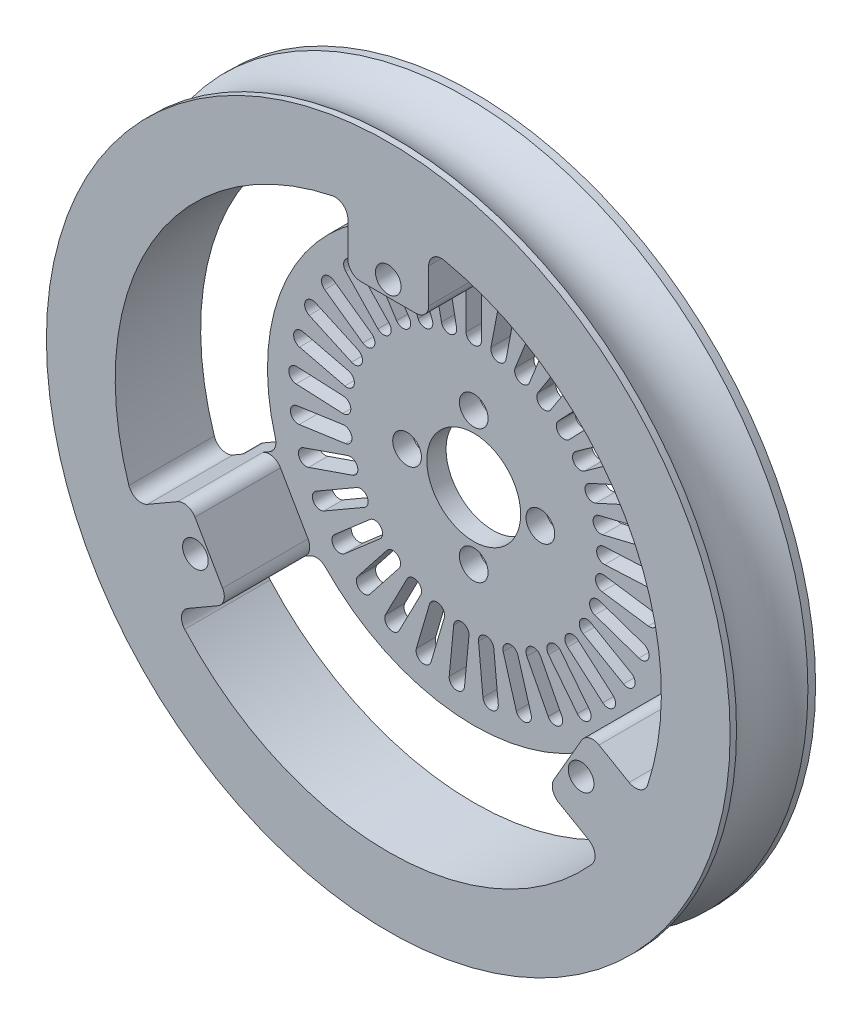
from build123d import *

# Parameters (mm, degrees)
ESQUISSE1_R             = 33.866666667
BOSS_EXTRU_1_DEPTH      = 8.466666667
ENL_V_MAT_EXTRU_1_REACH = 50.637
BOSS_EXTRU_2_DEPTH      = 1.905
ESQUISSE9_R             = 4.6482
ENL_V_MAT_EXTRU_5_DEPTH = 50.00483335
ESQUISSE10_R            = 1.4224
ENL_V_MAT_EXTRU_6_DEPTH = 49.637297074
ESQUISSE11_R            = 1.27
ENL_V_MAT_EXTRU_7_DEPTH = 50.00483335
ENL_V_MAT_EXTRU_8_DEPTH = 50.00483335


with BuildPart() as part:
    # Esquisse1 → Boss.-Extru.1 (new body)
    with BuildSketch(Plane.XY):
        Circle(ESQUISSE1_R)
    extrude(amount=BOSS_EXTRU_1_DEPTH)

    # Esquisse2 → Enlèv. mat.-Extru.1 (cut, up to next)
    with BuildSketch(Plane.XY.offset(8.466666667), mode=Mode.PRIVATE) as enl_v_mat_extru_1_sk1:
        with BuildLine():
            Line((4.0005, 25.236517009), (4.0005, 21.800553049))
            ThreePointArc((4.0005, 21.800553049), (3.628525612, 20.902527437), (2.7305, 20.530553049))
            Line((2.7305, 20.530553049), (-2.7305, 20.530553049))
            ThreePointArc((-2.7305, 20.530553049), (-3.628525612, 20.902527437), (-4.0005, 21.800553049))
            Line((-4.0005, 21.800553049), (-4.0005, 25.236517009))
            ThreePointArc((-4.0005, 25.236517009), (-4.469510234, 26.222070353), (-5.530130542, 26.479695187))
            ThreePointArc((-5.530130542, 26.479695187), (-23.426853198, 13.5255), (-25.697153987, -8.450614058))
            ThreePointArc((-25.697153987, -8.450614058), (-24.943734182, -9.240325772), (-23.855714833, -9.153723877))
            Line((-23.855714833, -9.153723877), (-20.880082757, -7.435741897))
            ThreePointArc((-20.880082757, -7.435741897), (-19.91638257, -7.30886836), (-19.145230494, -7.90059416))
            Line((-19.145230494, -7.90059416), (-16.414730494, -12.62995889))
            ThreePointArc((-16.414730494, -12.62995889), (-16.287856958, -13.593659077), (-16.879582757, -14.364811152))
            Line((-16.879582757, -14.364811152), (-19.855214833, -16.082793132))
            ThreePointArc((-19.855214833, -16.082793132), (-20.474223949, -16.981744581), (-20.167023445, -18.029081129))
            ThreePointArc((-20.167023445, -18.029081129), (0, -27.051), (20.167023445, -18.029081129))
            ThreePointArc((20.167023445, -18.029081129), (20.474223949, -16.981744581), (19.855214833, -16.082793132))
            Line((19.855214833, -16.082793132), (16.879582757, -14.364811152))
            ThreePointArc((16.879582757, -14.364811152), (16.287856958, -13.593659077), (16.414730494, -12.62995889))
            Line((16.414730494, -12.62995889), (19.145230494, -7.90059416))
            ThreePointArc((19.145230494, -7.90059416), (19.91638257, -7.30886836), (20.880082757, -7.435741897))
            Line((20.880082757, -7.435741897), (23.855714833, -9.153723877))
            ThreePointArc((23.855714833, -9.153723877), (24.943734182, -9.240325772), (25.697153987, -8.450614058))
            ThreePointArc((25.697153987, -8.450614058), (23.426853198, 13.5255), (5.530130542, 26.479695187))
            ThreePointArc((5.530130542, 26.479695187), (4.469510234, 26.222070353), (4.0005, 25.236517009))
        make_face()
    enl_v_mat_extru_1_tool1 = extrude(enl_v_mat_extru_1_sk1.sketch, amount=-ENL_V_MAT_EXTRU_1_REACH, mode=Mode.PRIVATE) & part.part
    add(enl_v_mat_extru_1_tool1.solids().sort_by_distance((0, 0, 8.466667))[0], mode=Mode.SUBTRACT)

    # Esquisse7 → Enlèvement de matière-Révolution4 (revolve, cut)
    with BuildSketch(Plane(origin=(0, 0, 0), x_dir=(1, 0, 0), z_dir=(0, 1, 0)), mode=Mode.PRIVATE) as enl_vement_de_mati_re_r_volution4_sk:
        with BuildLine():
            Line((-33.866666667, -0.762), (-33.866666667, -7.831666667))
            ThreePointArc((-33.866666667, -7.831666667), (-32.596666667, -4.296833333), (-33.866666667, -0.762))
        make_face()
    revolve(enl_vement_de_mati_re_r_volution4_sk.sketch.rotate(Axis((0, 0, 31.089854895), (0, 0, -1)), 180), axis=Axis((0, 0, 31.089854895), (0, 0, -1)), mode=Mode.SUBTRACT)

    # Esquisse8 → Boss.-Extru.2 (add)
    with BuildSketch(Plane.XY):
        with BuildLine():
            Line((-22.75586257, -8.518723877), (-20.234115503, -7.062792529))
            ThreePointArc((-20.234115503, -7.062792529), (-19.691815298, -6.43924293), (-19.64798528, -5.614026266))
            ThreePointArc((-19.64798528, -5.614026266), (-17.696622909, 10.21715), (-4.962103277, 19.822667519))
            ThreePointArc((-4.962103277, 19.822667519), (-4.269359691, 20.27323376), (-4.0005, 21.054654313))
            Line((-4.0005, 21.054654313), (-4.0005, 23.966517009))
            ThreePointArc((-4.0005, 23.966517009), (-3.628525612, 24.864542621), (-2.7305, 25.236517009))
            Line((-2.7305, 25.236517009), (2.7305, 25.236517009))
            ThreePointArc((2.7305, 25.236517009), (3.628525612, 24.864542621), (4.0005, 23.966517009))
            Line((4.0005, 23.966517009), (4.0005, 21.054654313))
            ThreePointArc((4.0005, 21.054654313), (4.269359691, 20.27323376), (4.962103277, 19.822667519))
            ThreePointArc((4.962103277, 19.822667519), (17.696622909, 10.21715), (19.64798528, -5.614026266))
            ThreePointArc((19.64798528, -5.614026266), (19.691815298, -6.43924293), (20.234115503, -7.062792529))
            Line((20.234115503, -7.062792529), (22.75586257, -8.518723877))
            ThreePointArc((22.75586257, -8.518723877), (23.347588369, -9.289875952), (23.220714833, -10.25357614))
            Line((23.220714833, -10.25357614), (20.490214833, -14.98294087))
            ThreePointArc((20.490214833, -14.98294087), (19.719062757, -15.574666669), (18.75536257, -15.447793132))
            Line((18.75536257, -15.447793132), (16.233615503, -13.991861784))
            ThreePointArc((16.233615503, -13.991861784), (15.422455608, -13.83399083), (14.685882004, -14.208641253))
            ThreePointArc((14.685882004, -14.208641253), (0, -20.4343), (-14.685882004, -14.208641253))
            ThreePointArc((-14.685882004, -14.208641253), (-15.422455608, -13.83399083), (-16.233615503, -13.991861784))
            Line((-16.233615503, -13.991861784), (-18.75536257, -15.447793132))
            ThreePointArc((-18.75536257, -15.447793132), (-19.719062757, -15.574666669), (-20.490214833, -14.98294087))
            Line((-20.490214833, -14.98294087), (-23.220714833, -10.25357614))
            ThreePointArc((-23.220714833, -10.25357614), (-23.347588369, -9.289875952), (-22.75586257, -8.518723877))
        make_face()
    extrude(amount=-BOSS_EXTRU_2_DEPTH)

    # Esquisse9 → Enlèv. mat.-Extru.5 (cut, through all)
    with BuildSketch(Plane(origin=(0, 0, -1.905), x_dir=(-1, 0, 0), z_dir=(0, 0, -1))):
        Circle(ESQUISSE9_R)
    extrude(amount=-ENL_V_MAT_EXTRU_5_DEPTH, mode=Mode.SUBTRACT)

    # Esquisse10 → Enlèv. mat.-Extru.6 (cut, through all)
    with BuildSketch(Plane.XY):
        with Locations((0, 6.604)):
            Circle(ESQUISSE10_R)
        with Locations((6.604, 0)):
            Circle(ESQUISSE10_R)
        with Locations((0, -6.604)):
            Circle(ESQUISSE10_R)
        with Locations((-6.604, 0)):
            Circle(ESQUISSE10_R)
    extrude(amount=-ENL_V_MAT_EXTRU_6_DEPTH, mode=Mode.SUBTRACT)

    # Esquisse11 → Enlèv. mat.-Extru.7 (cut, through all)
    with BuildSketch(Plane(origin=(0, 0, -1.905), x_dir=(-1, 0, 0), z_dir=(0, 0, -1))):
        with Locations((0, 22.061517009)):
            Circle(ESQUISSE11_R)
        with Locations((19.105834176, -11.030758505)):
            Circle(ESQUISSE11_R)
        with Locations((-19.105834176, -11.030758505)):
            Circle(ESQUISSE11_R)
    extrude(amount=-ENL_V_MAT_EXTRU_7_DEPTH, mode=Mode.SUBTRACT)

    # Esquisse12 → Enlèv. mat.-Extru.8 (cut, through all)
    with BuildSketch(Plane(origin=(0, 0, -1.905), x_dir=(-1, 0, 0), z_dir=(0, 0, -1))):
        with BuildLine():
            Line((0.762, 17.5768), (0.762, 12.954))
            ThreePointArc((0.762, 12.954), (0, 12.192), (-0.762, 12.954))
            Line((-0.762, 12.954), (-0.762, 17.5768))
            ThreePointArc((-0.762, 17.5768), (0, 18.3388), (0.762, 17.5768))
        make_face()
        with BuildLine():
            Line((4.074660939, 17.114954878), (3.199790287, 12.575694896))
            ThreePointArc((3.199790287, 12.575694896), (2.307351171, 11.971674677), (1.703330952, 12.864113793))
            Line((1.703330952, 12.864113793), (2.578201605, 17.403373774))
            ThreePointArc((2.578201605, 17.403373774), (3.47064072, 18.007393993), (4.074660939, 17.114954878))
        make_face()
        with BuildLine():
            Line((7.240053016, 16.034530694), (5.521931816, 11.742871413))
            ThreePointArc((5.521931816, 11.742871413), (4.531308659, 11.318661839), (4.107099086, 12.309284996))
            Line((4.107099086, 12.309284996), (5.825220286, 16.600944276))
            ThreePointArc((5.825220286, 16.600944276), (6.815843442, 17.02515385), (7.240053016, 16.034530694))
        make_face()
        with BuildLine():
            Line((10.143770712, 14.374576793), (7.644496341, 10.485629961))
            ThreePointArc((7.644496341, 10.485629961), (6.591492846, 10.256563072), (6.362425957, 11.309566567))
            Line((6.362425957, 11.309566567), (8.861700328, 15.198513399))
            ThreePointArc((8.861700328, 15.198513399), (9.914703823, 15.427580288), (10.143770712, 14.374576793))
        make_face()
        with BuildLine():
            Line((12.680866106, 12.195088234), (9.490768852, 8.849410523))
            ThreePointArc((9.490768852, 8.849410523), (8.413443308, 8.823765393), (8.387798178, 9.901090936))
            Line((8.387798178, 9.901090936), (11.577895432, 13.246768648))
            ThreePointArc((11.577895432, 13.246768648), (12.655220976, 13.272413778), (12.680866106, 12.195088234))
        make_face()
        with BuildLine():
            Line((14.759641959, 9.574837413), (10.994020248, 6.893350331))
            ThreePointArc((10.994020248, 6.893350331), (9.931310007, 7.072053841), (10.110013518, 8.134764082))
            Line((10.110013518, 8.134764082), (13.875635229, 10.816251164))
            ThreePointArc((13.875635229, 10.816251164), (14.938345469, 10.637547653), (14.759641959, 9.574837413))
        make_face()
        with BuildLine():
            Line((16.304965896, 6.60852702), (12.099919108, 4.688146498))
            ThreePointArc((12.099919108, 4.688146498), (11.090233287, 5.064739839), (11.466826628, 6.074425659))
            Line((11.466826628, 6.074425659), (15.671873416, 7.994806181))
            ThreePointArc((15.671873416, 7.994806181), (16.681559236, 7.61821284), (16.304965896, 6.60852702))
        make_face()
        with BuildLine():
            Line((17.260985883, 3.403367243), (12.768495365, 2.313500836))
            ThreePointArc((12.768495365, 2.313500836), (11.848326641, 2.874372942), (12.409198747, 3.794541666))
            Line((12.409198747, 3.794541666), (16.901689265, 4.884408073))
            ThreePointArc((16.901689265, 4.884408073), (17.821857989, 4.323535967), (17.260985883, 3.403367243))
        make_face()
        with BuildLine():
            Line((17.593148867, 0.075200906), (12.975584932, -0.144760775))
            ThreePointArc((12.975584932, -0.144760775), (12.178190599, 0.580118718), (12.903070092, 1.37751305))
            Line((12.903070092, 1.37751305), (17.520634027, 1.597474731))
            ThreePointArc((17.520634027, 1.597474731), (18.31802836, 0.872595238), (17.593148867, 0.075200906))
        make_face()
        with BuildLine():
            Line((17.289449613, -3.255683388), (12.713703051, -2.597790354))
            ThreePointArc((12.713703051, -2.597790354), (12.067903019, -1.735102508), (12.930590865, -1.089302476))
            Line((12.930590865, -1.089302476), (17.506337426, -1.747195511))
            ThreePointArc((17.506337426, -1.747195511), (18.152137458, -2.609883356), (17.289449613, -3.255683388))
        make_face()
        with BuildLine():
            Line((16.360864602, -6.468898801), (11.992314818, -4.956929021))
            ThreePointArc((11.992314818, -4.956929021), (11.521449982, -3.987612609), (12.490766394, -3.516747773))
            Line((12.490766394, -3.516747773), (16.859316178, -5.028717554))
            ThreePointArc((16.859316178, -5.028717554), (17.330181014, -5.998033966), (16.360864602, -6.468898801))
        make_face()
        with BuildLine():
            Line((14.840955317, -9.448311358), (10.837493081, -7.136911358))
            ThreePointArc((10.837493081, -7.136911358), (10.558581723, -6.096), (11.599493081, -5.817088642))
            Line((11.599493081, -5.817088642), (15.602955317, -8.128488642))
            ThreePointArc((15.602955317, -8.128488642), (15.881866675, -9.1694), (14.840955317, -9.448311358))
        make_face()
        with BuildLine():
            Line((12.784655239, -12.086237324), (9.290976107, -9.058947123))
            ThreePointArc((9.290976107, -9.058947123), (9.214098811, -7.984062068), (10.288983865, -7.907184772))
            Line((10.288983865, -7.907184772), (13.782662998, -10.934474973))
            ThreePointArc((13.782662998, -10.934474973), (13.859540294, -12.009360028), (12.784655239, -12.086237324))
        make_face()
        with BuildLine():
            Line((10.266284411, -14.287335183), (7.408659049, -10.653568937))
            ThreePointArc((7.408659049, -10.653568937), (7.53659436, -9.583559331), (8.606603966, -9.711494642))
            Line((8.606603966, -9.711494642), (11.464229327, -13.345260888))
            ThreePointArc((11.464229327, -13.345260888), (11.336294017, -14.415270494), (10.266284411, -14.287335183))
        make_face()
        with BuildLine():
            Line((7.376863315, -15.972051523), (5.258573751, -11.863143011))
            ThreePointArc((5.258573751, -11.863143011), (5.586697753, -10.83668179), (6.613158974, -11.164805792))
            Line((6.613158974, -11.164805792), (8.731448539, -15.273714304))
            ThreePointArc((8.731448539, -15.273714304), (8.403324537, -16.300175526), (7.376863315, -15.972051523))
        make_face()
        with BuildLine():
            Line((4.220823159, -17.079496307), (2.918429895, -12.643952189))
            ThreePointArc((2.918429895, -12.643952189), (3.434883333, -11.698138334), (4.380697187, -12.214591772))
            Line((4.380697187, -12.214591772), (5.683090451, -16.65013589))
            ThreePointArc((5.683090451, -16.65013589), (5.166637013, -17.595949745), (4.220823159, -17.079496307))
        make_face()
        with BuildLine():
            Line((0.912231457, -17.569643594), (0.47280638, -12.96777599))
            ThreePointArc((0.47280638, -12.96777599), (1.15892328, -12.13679368), (1.98990559, -12.82291058))
            Line((1.98990559, -12.82291058), (2.429330667, -17.424778184))
            ThreePointArc((2.429330667, -17.424778184), (1.743213767, -18.255760494), (0.912231457, -17.569643594))
        make_face()
        with BuildLine():
            Line((-2.429330667, -17.424778184), (-1.98990559, -12.82291058))
            ThreePointArc((-1.98990559, -12.82291058), (-1.15892328, -12.13679368), (-0.47280638, -12.96777599))
            Line((-0.47280638, -12.96777599), (-0.912231457, -17.569643594))
            ThreePointArc((-0.912231457, -17.569643594), (-1.743213767, -18.255760494), (-2.429330667, -17.424778184))
        make_face()
        with BuildLine():
            Line((-5.683090451, -16.65013589), (-4.380697187, -12.214591772))
            ThreePointArc((-4.380697187, -12.214591772), (-3.434883333, -11.698138334), (-2.918429895, -12.643952189))
            Line((-2.918429895, -12.643952189), (-4.220823159, -17.079496307))
            ThreePointArc((-4.220823159, -17.079496307), (-5.166637013, -17.595949745), (-5.683090451, -16.65013589))
        make_face()
        with BuildLine():
            Line((-8.731448539, -15.273714304), (-6.613158974, -11.164805792))
            ThreePointArc((-6.613158974, -11.164805792), (-5.586697753, -10.83668179), (-5.258573751, -11.863143011))
            Line((-5.258573751, -11.863143011), (-7.376863315, -15.972051523))
            ThreePointArc((-7.376863315, -15.972051523), (-8.403324537, -16.300175526), (-8.731448539, -15.273714304))
        make_face()
        with BuildLine():
            Line((-11.464229327, -13.345260888), (-8.606603966, -9.711494642))
            ThreePointArc((-8.606603966, -9.711494642), (-7.53659436, -9.583559331), (-7.408659049, -10.653568937))
            Line((-7.408659049, -10.653568937), (-10.266284411, -14.287335183))
            ThreePointArc((-10.266284411, -14.287335183), (-11.336294017, -14.415270494), (-11.464229327, -13.345260888))
        make_face()
        with BuildLine():
            Line((-13.782662998, -10.934474973), (-10.288983865, -7.907184772))
            ThreePointArc((-10.288983865, -7.907184772), (-9.214098811, -7.984062068), (-9.290976107, -9.058947123))
            Line((-9.290976107, -9.058947123), (-12.784655239, -12.086237324))
            ThreePointArc((-12.784655239, -12.086237324), (-13.859540294, -12.009360028), (-13.782662998, -10.934474973))
        make_face()
        with BuildLine():
            Line((-15.602955317, -8.128488642), (-11.599493081, -5.817088642))
            ThreePointArc((-11.599493081, -5.817088642), (-10.558581723, -6.096), (-10.837493081, -7.136911358))
            Line((-10.837493081, -7.136911358), (-14.840955317, -9.448311358))
            ThreePointArc((-14.840955317, -9.448311358), (-15.881866675, -9.1694), (-15.602955317, -8.128488642))
        make_face()
        with BuildLine():
            Line((-16.859316178, -5.028717554), (-12.490766394, -3.516747773))
            ThreePointArc((-12.490766394, -3.516747773), (-11.521449982, -3.987612609), (-11.992314818, -4.956929021))
            Line((-11.992314818, -4.956929021), (-16.360864602, -6.468898801))
            ThreePointArc((-16.360864602, -6.468898801), (-17.330181014, -5.998033966), (-16.859316178, -5.028717554))
        make_face()
        with BuildLine():
            Line((-17.506337426, -1.747195511), (-12.930590865, -1.089302476))
            ThreePointArc((-12.930590865, -1.089302476), (-12.067903019, -1.735102508), (-12.713703051, -2.597790354))
            Line((-12.713703051, -2.597790354), (-17.289449613, -3.255683388))
            ThreePointArc((-17.289449613, -3.255683388), (-18.152137458, -2.609883356), (-17.506337426, -1.747195511))
        make_face()
        with BuildLine():
            Line((-17.520634027, 1.597474731), (-12.903070092, 1.37751305))
            ThreePointArc((-12.903070092, 1.37751305), (-12.178190599, 0.580118718), (-12.975584932, -0.144760775))
            Line((-12.975584932, -0.144760775), (-17.593148867, 0.075200906))
            ThreePointArc((-17.593148867, 0.075200906), (-18.31802836, 0.872595238), (-17.520634027, 1.597474731))
        make_face()
        with BuildLine():
            Line((-16.901689265, 4.884408073), (-12.409198747, 3.794541666))
            ThreePointArc((-12.409198747, 3.794541666), (-11.848326641, 2.874372942), (-12.768495365, 2.313500836))
            Line((-12.768495365, 2.313500836), (-17.260985883, 3.403367243))
            ThreePointArc((-17.260985883, 3.403367243), (-17.821857989, 4.323535967), (-16.901689265, 4.884408073))
        make_face()
        with BuildLine():
            Line((-15.671873416, 7.994806181), (-11.466826628, 6.074425659))
            ThreePointArc((-11.466826628, 6.074425659), (-11.090233287, 5.064739839), (-12.099919108, 4.688146498))
            Line((-12.099919108, 4.688146498), (-16.304965896, 6.60852702))
            ThreePointArc((-16.304965896, 6.60852702), (-16.681559236, 7.61821284), (-15.671873416, 7.994806181))
        make_face()
        with BuildLine():
            Line((-13.875635229, 10.816251164), (-10.110013518, 8.134764082))
            ThreePointArc((-10.110013518, 8.134764082), (-9.931310007, 7.072053841), (-10.994020248, 6.893350331))
            Line((-10.994020248, 6.893350331), (-14.759641959, 9.574837413))
            ThreePointArc((-14.759641959, 9.574837413), (-14.938345469, 10.637547653), (-13.875635229, 10.816251164))
        make_face()
        with BuildLine():
            Line((-11.577895432, 13.246768648), (-8.387798178, 9.901090936))
            ThreePointArc((-8.387798178, 9.901090936), (-8.413443308, 8.823765393), (-9.490768852, 8.849410523))
            Line((-9.490768852, 8.849410523), (-12.680866106, 12.195088234))
            ThreePointArc((-12.680866106, 12.195088234), (-12.655220976, 13.272413778), (-11.577895432, 13.246768648))
        make_face()
        with BuildLine():
            Line((-8.861700328, 15.198513399), (-6.362425957, 11.309566567))
            ThreePointArc((-6.362425957, 11.309566567), (-6.591492846, 10.256563072), (-7.644496341, 10.485629961))
            Line((-7.644496341, 10.485629961), (-10.143770712, 14.374576793))
            ThreePointArc((-10.143770712, 14.374576793), (-9.914703823, 15.427580288), (-8.861700328, 15.198513399))
        make_face()
        with BuildLine():
            Line((-5.825220286, 16.600944276), (-4.107099086, 12.309284996))
            ThreePointArc((-4.107099086, 12.309284996), (-4.531308659, 11.318661839), (-5.521931816, 11.742871413))
            Line((-5.521931816, 11.742871413), (-7.240053016, 16.034530694))
            ThreePointArc((-7.240053016, 16.034530694), (-6.815843442, 17.02515385), (-5.825220286, 16.600944276))
        make_face()
        with BuildLine():
            Line((-2.578201605, 17.403373774), (-1.703330952, 12.864113793))
            ThreePointArc((-1.703330952, 12.864113793), (-2.307351171, 11.971674677), (-3.199790287, 12.575694896))
            Line((-3.199790287, 12.575694896), (-4.074660939, 17.114954878))
            ThreePointArc((-4.074660939, 17.114954878), (-3.47064072, 18.007393993), (-2.578201605, 17.403373774))
        make_face()
    extrude(amount=-ENL_V_MAT_EXTRU_8_DEPTH, mode=Mode.SUBTRACT)


solid = part.part
